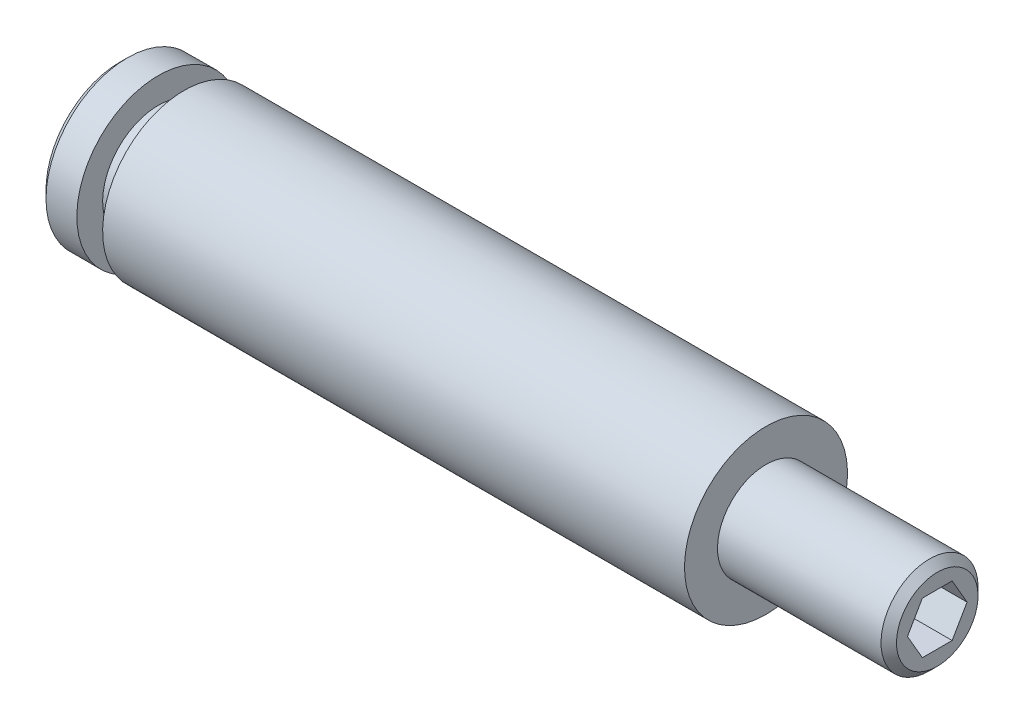
from build123d import *

# Parameters (mm, degrees)
CUT_EXTRUDE1_DEPTH = 9.525
CHAMFER1_SIZE      = 0.9525


with BuildPart() as part:
    # Sketch1 → Revolve1 (revolve)
    with BuildSketch(Plane.XY, mode=Mode.PRIVATE) as revolve1_sk:
        Polygon((0, 0), (100.6348, 0), (100.6348, 5.969), (79.5528, 5.969), (79.5528, 10.033), (7.9248, 10.033), (7.9248, 6.858), (4.7498, 6.858), (4.7498, 10.033), (0, 10.033), align=None)
    revolve(revolve1_sk.sketch.rotate(Axis((0, 0, 0), (1, 0, 0)), 180), axis=Axis((0, 0, 0), (1, 0, 0)))

    # Sketch2 → Cut-Extrude1 (cut)
    with BuildSketch(Plane(origin=(100.6348, 0, 0), x_dir=(0, 0, -1), z_dir=(1, 0, 0))):
        Polygon((3.666174209, 0), (1.833087105, 3.175), (-1.833087105, 3.175), (-3.666174209, 0), (-1.833087105, -3.175), (1.833087105, -3.175), align=None)
    extrude(amount=-CUT_EXTRUDE1_DEPTH, mode=Mode.SUBTRACT)

    # Chamfer1
    chamfer1_edges = [part.edges().sort_by_distance(p)[0] for p in [
        (100.6348, 5.969, 0),
        (0, 10.033, 0),
    ]]
    chamfer(chamfer1_edges, length=CHAMFER1_SIZE)


solid = part.part
